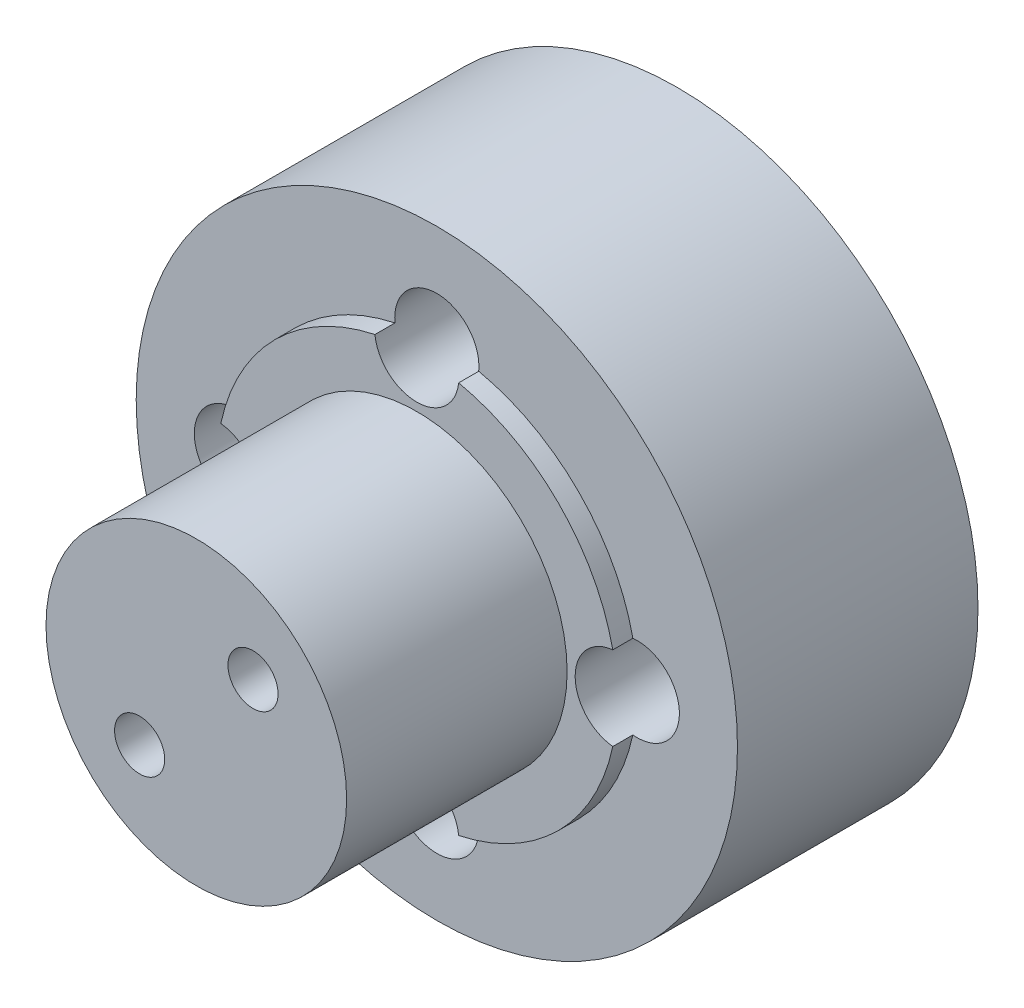
from build123d import *

# Parameters (mm, degrees)
SKETCH_1_R      = 15
EXTRUDE_1_DEPTH = 12
SKETCH_2_R      = 10
EXTRUDE_2_DEPTH = 1
SKETCH_3_R      = 7.5
EXTRUDE_3_DEPTH = 11
M5X0_81_D       = 4.2
M3X0_51_D       = 2.5


with BuildPart() as part:
    # Эскиз1 → Бобышка-Вытянуть1 (new body)
    with BuildSketch(Plane.XY):
        Circle(SKETCH_1_R)
    extrude(amount=EXTRUDE_1_DEPTH)

    # Эскиз2 → Бобышка-Вытянуть2 (add)
    with BuildSketch(Plane.XY.offset(12)):
        Circle(SKETCH_2_R)
    extrude(amount=EXTRUDE_2_DEPTH)

    # Эскиз3 → Бобышка-Вытянуть3 (add)
    with BuildSketch(Plane.XY.offset(13)):
        Circle(SKETCH_3_R)
    extrude(amount=EXTRUDE_3_DEPTH)

    # Отверстие обработанное метчиком M5x0.81 (through all)
    with Locations(Plane(origin=(0, 0, 0), x_dir=(-1, 0, 0), z_dir=(0, 0, -1))):
        with Locations((0, 10), (10, 0), (-10, 0), (0, -10)):
            Hole(M5X0_81_D / 2)

    # Отверстие обработанное метчиком M3x0.51 (through all)
    with Locations(Plane.XY.offset(24)):
        with Locations((-2.828427125, -2.828427125), (2.828427125, 2.828427125)):
            Hole(M3X0_51_D / 2)


solid = part.part
